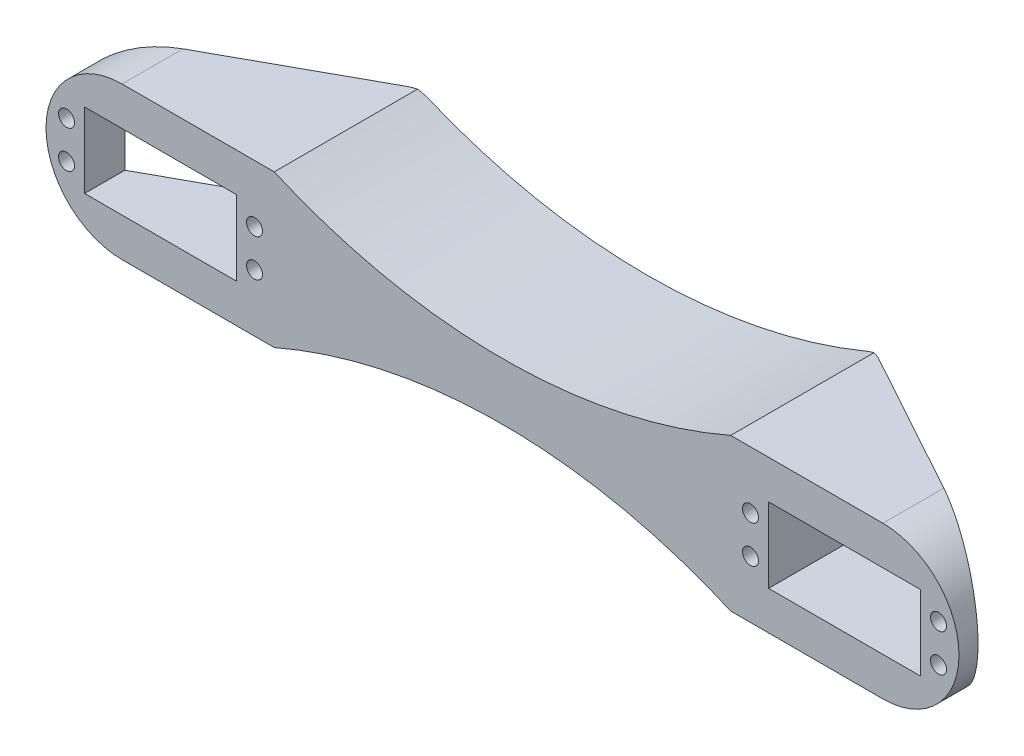
from build123d import *

# Parameters (mm, degrees)
SKETCH1_R           = 2.73935274
BOSS_EXTRUDE1_DEPTH = 60
SKETCH17_R          = 2.1
SKETCH17_W          = 39.9
SKETCH17_H          = 19.7
CUT_EXTRUDE10_DEPTH = 158.954623162
CUT_EXTRUDE11_DEPTH = 159.304157008
SKETCH19_W          = 123.088854382
SKETCH19_H          = 22
CUT_EXTRUDE12_DEPTH = 159.304157008
CUT_EXTRUDE14_DEPTH = 151.975703271
FILLET3_R           = 10
FILLET4_R           = 10
SKETCH16_R          = 2.1
SKETCH16_W          = 39.9
SKETCH16_H          = 19.7
CUT_EXTRUDE15_DEPTH = 40


with BuildPart() as part:
    # Sketch1 → Boss-Extrude1 (new body)
    with BuildSketch(Plane.XY):
        with BuildLine():
            Line((-79.073756432, 38.59348199), (120.926243568, 38.59348199))
            ThreePointArc((120.926243568, 38.59348199), (140.926243568, 18.59348199), (120.926243568, -1.40651801))
            Line((120.926243568, -1.40651801), (-79.073756432, -1.40651801))
            ThreePointArc((-79.073756432, -1.40651801), (-99.073756432, 18.59348199), (-79.073756432, 38.59348199))
        make_face()
        with Locations((-79.073756432, 18.59348199)):
            Circle(SKETCH1_R, mode=Mode.SUBTRACT)
        with Locations((120.926243568, 18.59348199)):
            Circle(SKETCH1_R, mode=Mode.SUBTRACT)
    extrude(amount=BOSS_EXTRUDE1_DEPTH)

    # Sketch17 → Cut-Extrude10 (cut, through all)
    with BuildSketch(Plane.XY.offset(60)):
        with Locations((86.11509795, 23.51848199)):
            Circle(SKETCH17_R)
        with Locations((86.11509795, 13.66848199)):
            Circle(SKETCH17_R)
        with Locations((135.537389186, 23.51848199)):
            Circle(SKETCH17_R)
        with Locations((135.537389186, 13.66848199)):
            Circle(SKETCH17_R)
        with Locations((110.826243568, 18.59348199)):
            Rectangle(SKETCH17_W, SKETCH17_H)
    extrude(amount=-CUT_EXTRUDE10_DEPTH, mode=Mode.SUBTRACT)

    # Sketch18 → Cut-Extrude11 (cut, through all)
    with BuildSketch(Plane(origin=(0, -1.40651801, 0), x_dir=(-1, 0, 0), z_dir=(0, -1, 0))):
        Polygon((-140.926243568, -55), (-140.926243568, 0), (-40.926243568, 0), align=None)
        Polygon((99.073756432, -55), (99.073756432, 0), (-0.926243568, 0), align=None)
    extrude(amount=-CUT_EXTRUDE11_DEPTH, mode=Mode.SUBTRACT)

    # Sketch19 → Cut-Extrude12 (cut, through all)
    with BuildSketch(Plane(origin=(0, -1.40651801, 0), x_dir=(-1, 0, 0), z_dir=(0, -1, 0))):
        with Locations((-19.381816377, -11)):
            Rectangle(SKETCH19_W, SKETCH19_H)
    extrude(amount=-CUT_EXTRUDE12_DEPTH, mode=Mode.SUBTRACT)

    # Sketch22 → Cut-Extrude14 (cut, through all)
    with BuildSketch(Plane(origin=(0, 0, 22), x_dir=(-1, 0, 0), z_dir=(0, 0, -1))):
        with BuildLine():
            Line((-80.926243568, 38.59348199), (39.073756432, 38.59348199))
            ThreePointArc((39.073756432, 38.59348199), (-20.926243568, 26.070752838), (-80.926243568, 38.59348199))
        make_face()
        with BuildLine():
            Line((-80.926243568, -1.40651801), (39.073756432, -1.40651801))
            ThreePointArc((39.073756432, -1.40651801), (-20.926243568, 11.116211141), (-80.926243568, -1.40651801))
        make_face()
    extrude(amount=-CUT_EXTRUDE14_DEPTH, mode=Mode.SUBTRACT)

    # Fillet3
    fillet3_edges = [part.edges().sort_by_distance(p)[0] for p in [
        (80.926243568, 18.59348199, 22),
    ]]
    fillet(fillet3_edges, radius=FILLET3_R)

    # Fillet4
    fillet4_edges = [part.edges().sort_by_distance(p)[0] for p in [
        (-39.073756432, 18.59348199, 22),
    ]]
    fillet(fillet4_edges, radius=FILLET4_R)

    # Sketch16 → Cut-Extrude15 (cut)
    with BuildSketch(Plane.XY.offset(60)):
        with Locations((-93.68490205, 23.51848199)):
            Circle(SKETCH16_R)
        with Locations((-93.68490205, 13.66848199)):
            Circle(SKETCH16_R)
        with Locations((-44.262610814, 23.51848199)):
            Circle(SKETCH16_R)
        with Locations((-44.262610814, 13.66848199)):
            Circle(SKETCH16_R)
        with Locations((-68.973756432, 18.59348199)):
            Rectangle(SKETCH16_W, SKETCH16_H)
    extrude(amount=-CUT_EXTRUDE15_DEPTH, mode=Mode.SUBTRACT)


solid = part.part
